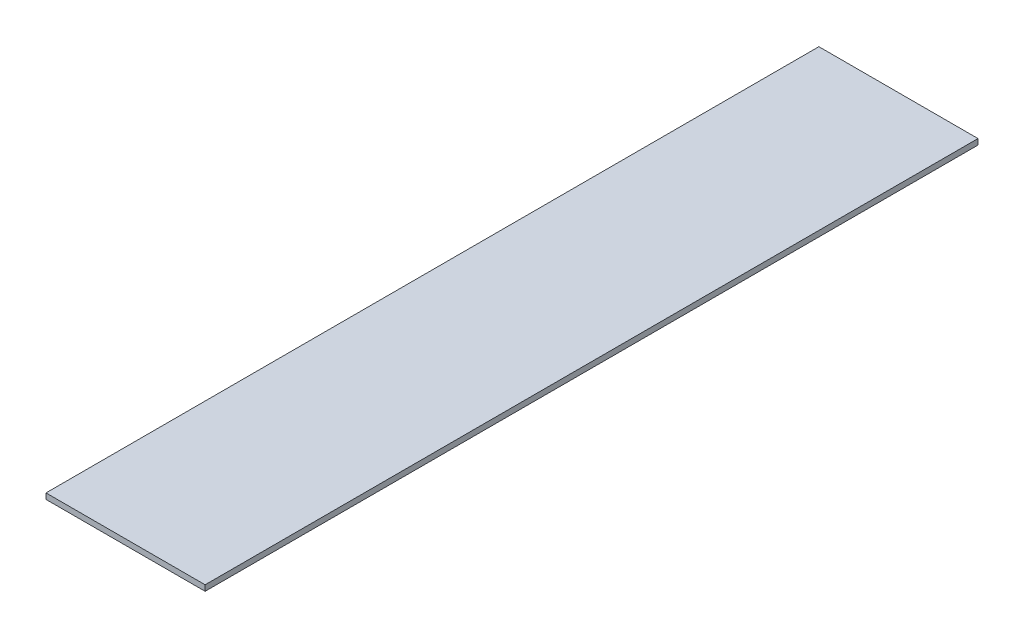
from build123d import *

# Parameters (mm, degrees)
KAP_PC_KAPAK_GECMELI_1_START = -20
SKETCH1_W                    = 140
SKETCH1_H                    = 5
KAP_PC_KAPAK_GECMELI_1_DEPTH = 680


with BuildPart() as part:
    # Sketch1 → KAP_PC_kapak_gecmeli_1 (new body)
    with BuildSketch(Plane.XY.offset(KAP_PC_KAPAK_GECMELI_1_START)):
        with Locations((0, 257.5)):
            Rectangle(SKETCH1_W, SKETCH1_H)
    extrude(amount=-KAP_PC_KAPAK_GECMELI_1_DEPTH)


solid = part.part
